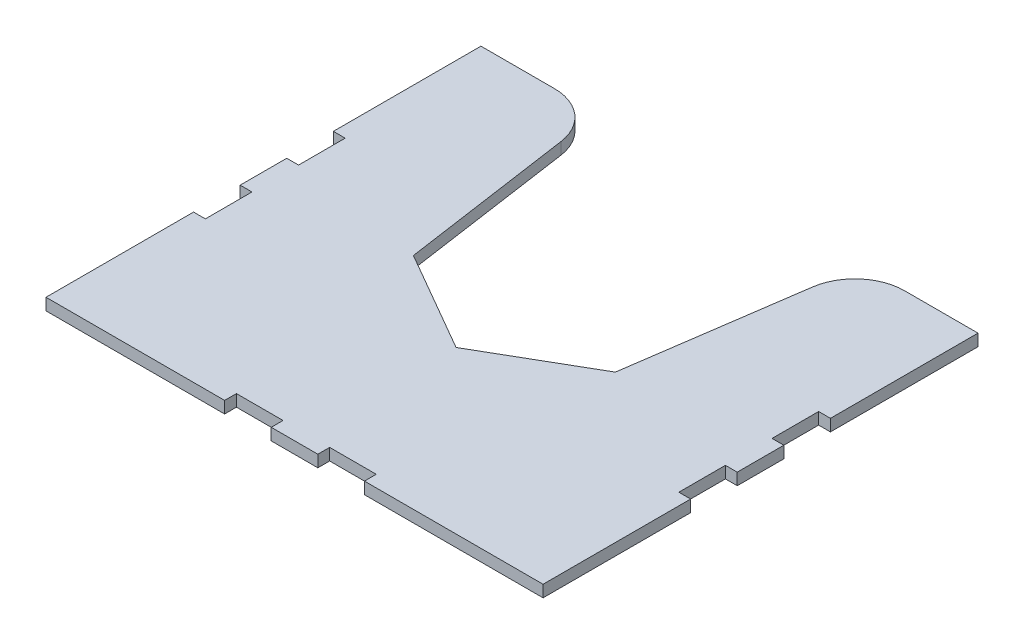
from build123d import *

# Parameters (mm, degrees)
SKETCH1_W             = 203.2
SKETCH1_H             = 177.8
BASE_DEPTH            = 4.826
CENTER_CUT_DEPTH      = 271.048829429
LEADING_EDGE_FILLET_R = 20.32
SKETCH3_W             = 4.826
SKETCH3_H             = 19.05
SIDE_SLOTS_DEPTH      = 271.048829429
SKETCH4_W             = 19.05
SKETCH4_H             = 4.826
REAR_SLOTS_DEPTH      = 271.048829429


with BuildPart() as part:
    # Sketch1 → Base (new body)
    with BuildSketch(Plane(origin=(0, 0, 0), x_dir=(1, 0, 0), z_dir=(0, 1, 0))):
        with Locations((101.6, 88.9)):
            Rectangle(SKETCH1_W, SKETCH1_H)
    extrude(amount=BASE_DEPTH)

    # Sketch2 → Center Cut (cut, through all)
    with BuildSketch(Plane(origin=(0, 4.826, 0), x_dir=(1, 0, 0), z_dir=(0, 1, 0))):
        Polygon((60.325, 89.870132361), (101.6, 66.04), (142.875, 89.870132361), (155.575, 177.8), (47.625, 177.8), align=None)
    extrude(amount=-CENTER_CUT_DEPTH, mode=Mode.SUBTRACT)

    # Leading Edge Fillet
    leading_edge_fillet_edges = [part.edges().sort_by_distance(p)[0] for p in [
        (47.625, 2.413, -177.8),
        (155.575, 2.413, -177.8),
    ]]
    fillet(leading_edge_fillet_edges, radius=LEADING_EDGE_FILLET_R)

    # Sketch3 → Side Slots (cut, through all)
    with BuildSketch(Plane(origin=(0, 4.826, 0), x_dir=(1, 0, 0), z_dir=(0, 1, 0))):
        with Locations((2.413, 107.95)):
            Rectangle(SKETCH3_W, SKETCH3_H)
        with Locations((2.413, 69.85)):
            Rectangle(SKETCH3_W, SKETCH3_H)
        with Locations((200.787, 69.85)):
            Rectangle(SKETCH3_W, SKETCH3_H)
        with Locations((200.787, 107.95)):
            Rectangle(SKETCH3_W, SKETCH3_H)
    extrude(amount=-SIDE_SLOTS_DEPTH, mode=Mode.SUBTRACT)

    # Sketch4 → Rear Slots (cut, through all)
    with BuildSketch(Plane(origin=(0, 4.826, 0), x_dir=(1, 0, 0), z_dir=(0, 1, 0))):
        with Locations((82.55, 2.413)):
            Rectangle(SKETCH4_W, SKETCH4_H)
        with Locations((120.65, 2.413)):
            Rectangle(SKETCH4_W, SKETCH4_H)
    extrude(amount=-REAR_SLOTS_DEPTH, mode=Mode.SUBTRACT)


solid = part.part
